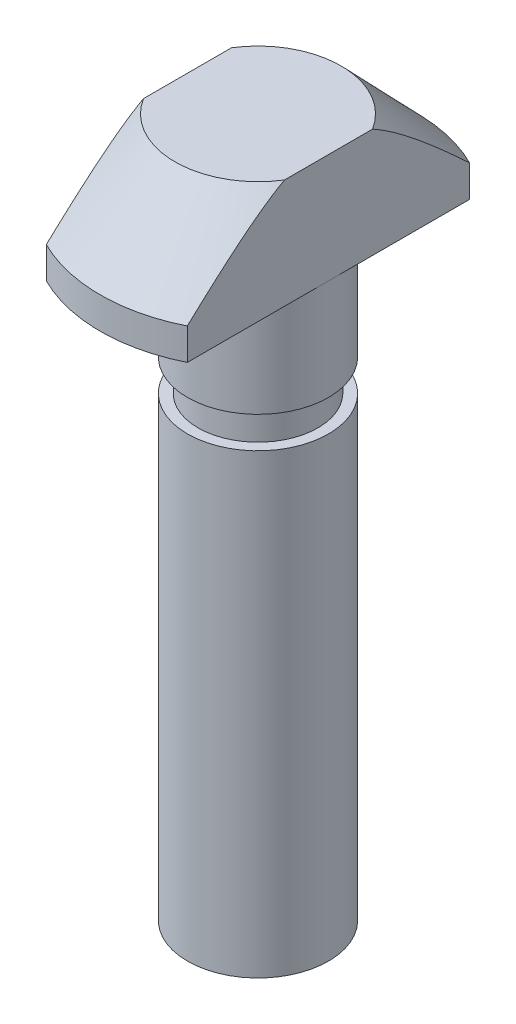
from build123d import *

# Parameters (mm, degrees)
SKETCH_3_W          = 7.345326746
SKETCH_3_H          = 8.819653772
SKETCH_3_W_2        = 8.702196558
SKETCH_3_H_2        = 9.976983905
CUT_EXTRUDE_1_DEPTH = 50


with BuildPart() as part:
    # 草图1 → 旋转1 (revolve)
    with BuildSketch(Plane.XY, mode=Mode.PRIVATE) as revolve_1_sk:
        Polygon((3.95, 33.2), (0, 33.2), (0, 0), (3.35, 0), (3.35, 21.7), (2.85, 21.7), (2.85, 23.2), (3.35, 23.2), (3.35, 28), (7.5, 28), (7.5, 29.5), align=None)
    revolve(revolve_1_sk.sketch.rotate(Axis((0, 33.2, 0), (0, 1, 0)), 270), axis=Axis((0, 33.2, 0), (0, 1, 0)))

    # 草图3 → 切除-拉伸1 (cut, symmetric)
    with BuildSketch(Plane.XY):
        with Locations((-7.022663373, 29.230861624)):
            Rectangle(SKETCH_3_W, SKETCH_3_H)
        with Locations((7.701098279, 29.530171142)):
            Rectangle(SKETCH_3_W_2, SKETCH_3_H_2)
    extrude(amount=CUT_EXTRUDE_1_DEPTH, both=True, mode=Mode.SUBTRACT)

    # 草图4 → 切除-旋转1 (revolve, cut)
    with BuildSketch(Plane(origin=(0, 0, 0), x_dir=(0, 0, -1), z_dir=(1, 0, 0)), mode=Mode.PRIVATE) as cut_revolve_1_sk:
        Polygon((3.35, 5.440830549), (1.65, 5.440830549), (1.65, 6.940830549), (3.35, 8.640830549), align=None)
    revolve(cut_revolve_1_sk.sketch.rotate(Axis((0, 5.440830549, -3.35), (0, 0, 1)), 90), axis=Axis((0, 5.440830549, -3.35), (0, 0, 1)), mode=Mode.SUBTRACT)


solid = part.part
